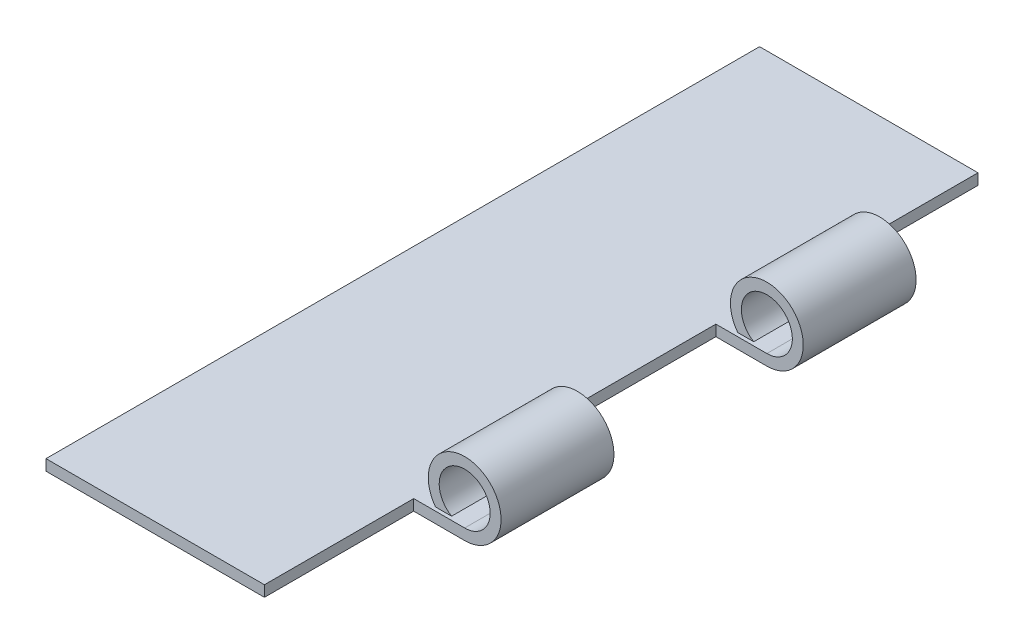
from build123d import *

# Parameters (mm, degrees)
BOSS_EXTRUDE1_DEPTH = 98
SKETCH2_W           = 7
SKETCH2_H           = 16
SKETCH2_W_2         = 13.165812667
SKETCH2_H_2         = 15.5
CUT_EXTRUDE1_DEPTH  = 108.088748242
SKETCH4_W           = 12.746406598
SKETCH4_H           = 11.424724901
CUT_EXTRUDE3_DEPTH  = 5
SKETCH5_W           = 15.019607204
SKETCH5_H           = 11.204049301
CUT_EXTRUDE4_DEPTH  = 5
SKETCH6_W           = 13.795170111
SKETCH6_H           = 11.126039216
CUT_EXTRUDE5_DEPTH  = 5
SKETCH7_W           = 13.688711878
SKETCH7_H           = 12.195602477
CUT_EXTRUDE6_DEPTH  = 5


with BuildPart() as part:
    # Sketch1 → Boss-Extrude1 (new body)
    with BuildSketch(Plane.XY):
        with BuildLine():
            Line((0, 0), (30, 0))
            Line((30, 0), (32, 0))
            Line((32, 0), (37, 0))
            ThreePointArc((37, 0), (39.236067977, 9.472135955), (33, 2))
            Line((33, 2), (35.197224362, 2))
            ThreePointArc((35.197224362, 2), (37.935414347, 8.372684391), (37, 1.5))
            Line((37, 1.5), (32, 1.5))
            Line((32, 1.5), (30, 1.5))
            Line((30, 1.5), (0, 1.5))
            Line((0, 1.5), (0, 0))
        make_face()
    extrude(amount=BOSS_EXTRUDE1_DEPTH)

    # Sketch2 → Cut-Extrude1 (cut, through all)
    with BuildSketch(Plane.XZ):
        with Locations((33.5, 49)):
            Rectangle(SKETCH2_W, SKETCH2_H)
        with Locations((43.582906334, 49)):
            Rectangle(SKETCH2_W_2, SKETCH2_H)
        with Locations((33.5, 7.75)):
            Rectangle(SKETCH2_W, SKETCH2_H_2)
        with Locations((43.582906334, 7.75)):
            Rectangle(SKETCH2_W_2, SKETCH2_H_2)
        with Locations((33.5, 90.25)):
            Rectangle(SKETCH2_W, SKETCH2_H_2)
        with Locations((43.582906334, 90.25)):
            Rectangle(SKETCH2_W_2, SKETCH2_H_2)
    extrude(amount=-CUT_EXTRUDE1_DEPTH, mode=Mode.SUBTRACT)

    # Sketch4 → Cut-Extrude3 (cut)
    with BuildSketch(Plane.XY.offset(82.5)):
        with Locations((36.373203299, 5.712362451)):
            Rectangle(SKETCH4_W, SKETCH4_H)
    extrude(amount=-CUT_EXTRUDE3_DEPTH, mode=Mode.SUBTRACT)

    # Sketch5 → Cut-Extrude4 (cut)
    with BuildSketch(Plane(origin=(0, 0, 57), x_dir=(-1, 0, 0), z_dir=(0, 0, -1))):
        with Locations((-37.509803602, 5.602024651)):
            Rectangle(SKETCH5_W, SKETCH5_H)
    extrude(amount=-CUT_EXTRUDE4_DEPTH, mode=Mode.SUBTRACT)

    # Sketch6 → Cut-Extrude5 (cut)
    with BuildSketch(Plane.XY.offset(41)):
        with Locations((36.897585056, 5.563019608)):
            Rectangle(SKETCH6_W, SKETCH6_H)
    extrude(amount=-CUT_EXTRUDE5_DEPTH, mode=Mode.SUBTRACT)

    # Sketch7 → Cut-Extrude6 (cut)
    with BuildSketch(Plane(origin=(0, 0, 15.5), x_dir=(-1, 0, 0), z_dir=(0, 0, -1))):
        with Locations((-36.844355939, 6.097801239)):
            Rectangle(SKETCH7_W, SKETCH7_H)
    extrude(amount=-CUT_EXTRUDE6_DEPTH, mode=Mode.SUBTRACT)


solid = part.part
